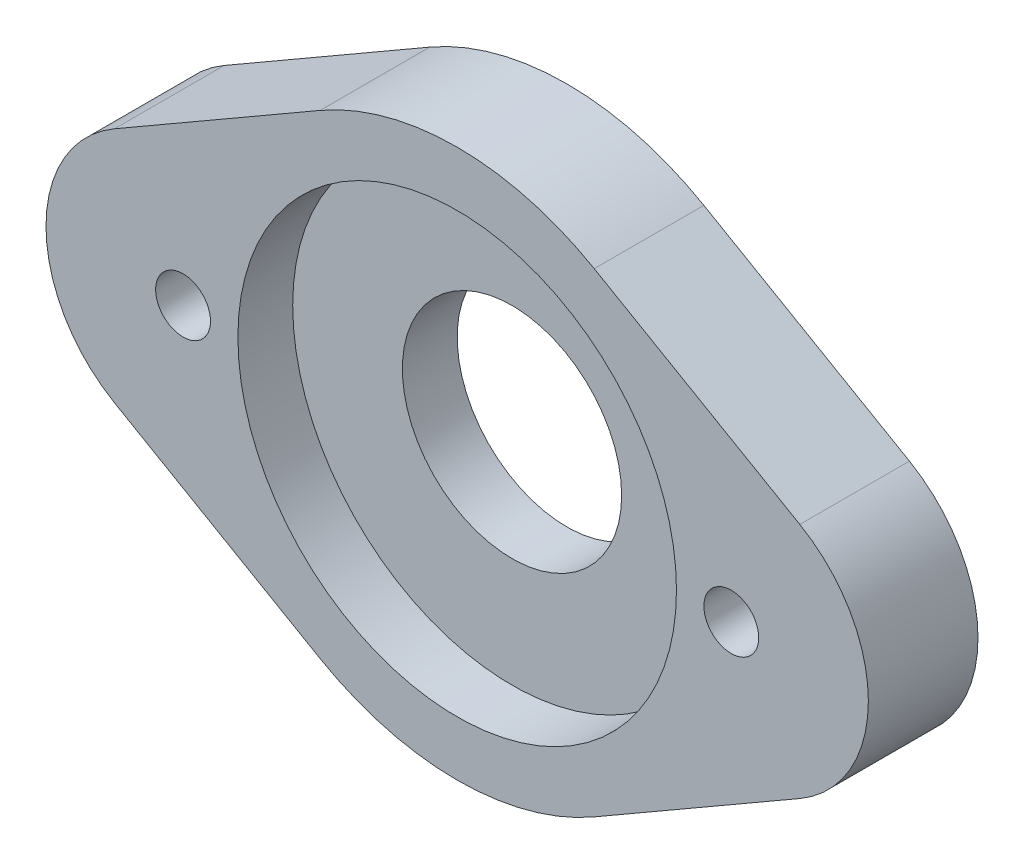
from build123d import *

# Parameters (mm, degrees)
EXTRUDE_1_DEPTH     = 10
SKETCH_2_R          = 20
CUT_EXTRUDE_1_DEPTH = 5
CUT_EXTRUDE_2_REACH = 47.346
SKETCH_3_R          = 10
CUT_EXTRUDE_3_REACH = 48.165
SKETCH_4_R          = 2.5


with BuildPart() as part:
    # 草图1 → 凸台-拉伸1 (new body)
    with BuildSketch(Plane.XY):
        with BuildLine():
            Line((12.5, 21.650635095), (31.25, 10.825317547))
            ThreePointArc((31.25, 10.825317547), (37.5, 0), (31.25, -10.825317547))
            Line((31.25, -10.825317547), (12.5, -21.650635095))
            ThreePointArc((12.5, -21.650635095), (0, -25), (-12.5, -21.650635095))
            Line((-12.5, -21.650635095), (-31.25, -10.825317547))
            ThreePointArc((-31.25, -10.825317547), (-37.5, 0), (-31.25, 10.825317547))
            Line((-31.25, 10.825317547), (-12.5, 21.650635095))
            ThreePointArc((-12.5, 21.650635095), (0, 25), (12.5, 21.650635095))
        make_face()
    extrude(amount=EXTRUDE_1_DEPTH)

    # 草图2 → 切除-拉伸1 (cut)
    with BuildSketch(Plane.XY.offset(10)):
        Circle(SKETCH_2_R)
    extrude(amount=-CUT_EXTRUDE_1_DEPTH, mode=Mode.SUBTRACT)

    # 草图3 → 切除-拉伸2 (cut, up to next)
    with BuildSketch(Plane.XY.offset(5), mode=Mode.PRIVATE) as cut_extrude_2_sk1:
        Circle(SKETCH_3_R)
    cut_extrude_2_tool1 = extrude(cut_extrude_2_sk1.sketch, amount=-CUT_EXTRUDE_2_REACH, mode=Mode.PRIVATE) & part.part
    add(cut_extrude_2_tool1.solids().sort_by_distance((0, 0, 5))[0], mode=Mode.SUBTRACT)

    # 草图4 → 切除-拉伸3 (cut, up to next)
    with BuildSketch(Plane.XY.offset(10), mode=Mode.PRIVATE) as cut_extrude_3_sk1:
        with Locations((-25, 0)):
            Circle(SKETCH_4_R)
    cut_extrude_3_tool1 = extrude(cut_extrude_3_sk1.sketch, amount=-CUT_EXTRUDE_3_REACH, mode=Mode.PRIVATE) & part.part
    cut_extrude_3 = cut_extrude_3_tool1.solids().sort_by_distance((-25, 0, 10))[0]
    add(cut_extrude_3, mode=Mode.SUBTRACT)

    # 镜向1: 切除-拉伸3 across plane
    add(cut_extrude_3.mirror(Plane(origin=(0, 0, 0), x_dir=(0, 0, 1), z_dir=(1, 0, 0))), mode=Mode.SUBTRACT)


solid = part.part
